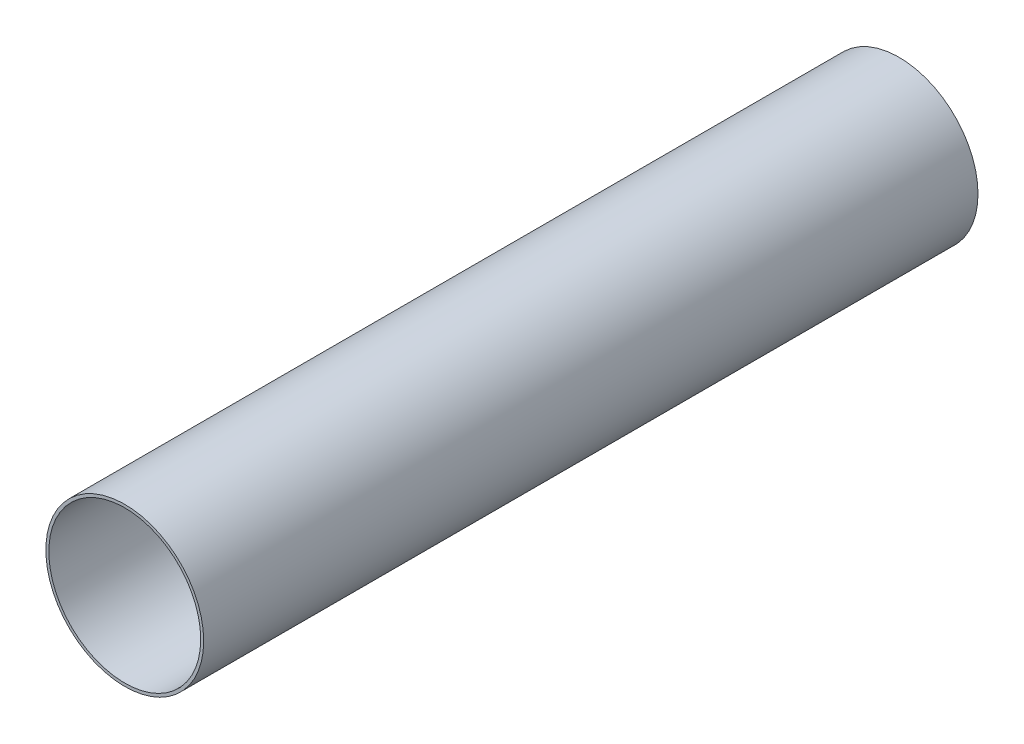
from build123d import *

# Parameters (mm, degrees)
SKETCH1_R           = 13.25
BOSS_EXTRUDE1_DEPTH = 130
SKETCH2_R           = 12.75
CUT_EXTRUDE1_DEPTH  = 132.343538098


with BuildPart() as part:
    # Sketch1 → Boss-Extrude1 (new body)
    with BuildSketch(Plane.XY):
        Circle(SKETCH1_R)
    extrude(amount=BOSS_EXTRUDE1_DEPTH)

    # Sketch2 → Cut-Extrude1 (cut, through all)
    with BuildSketch(Plane.XY.offset(130)):
        Circle(SKETCH2_R)
    extrude(amount=-CUT_EXTRUDE1_DEPTH, mode=Mode.SUBTRACT)


solid = part.part
